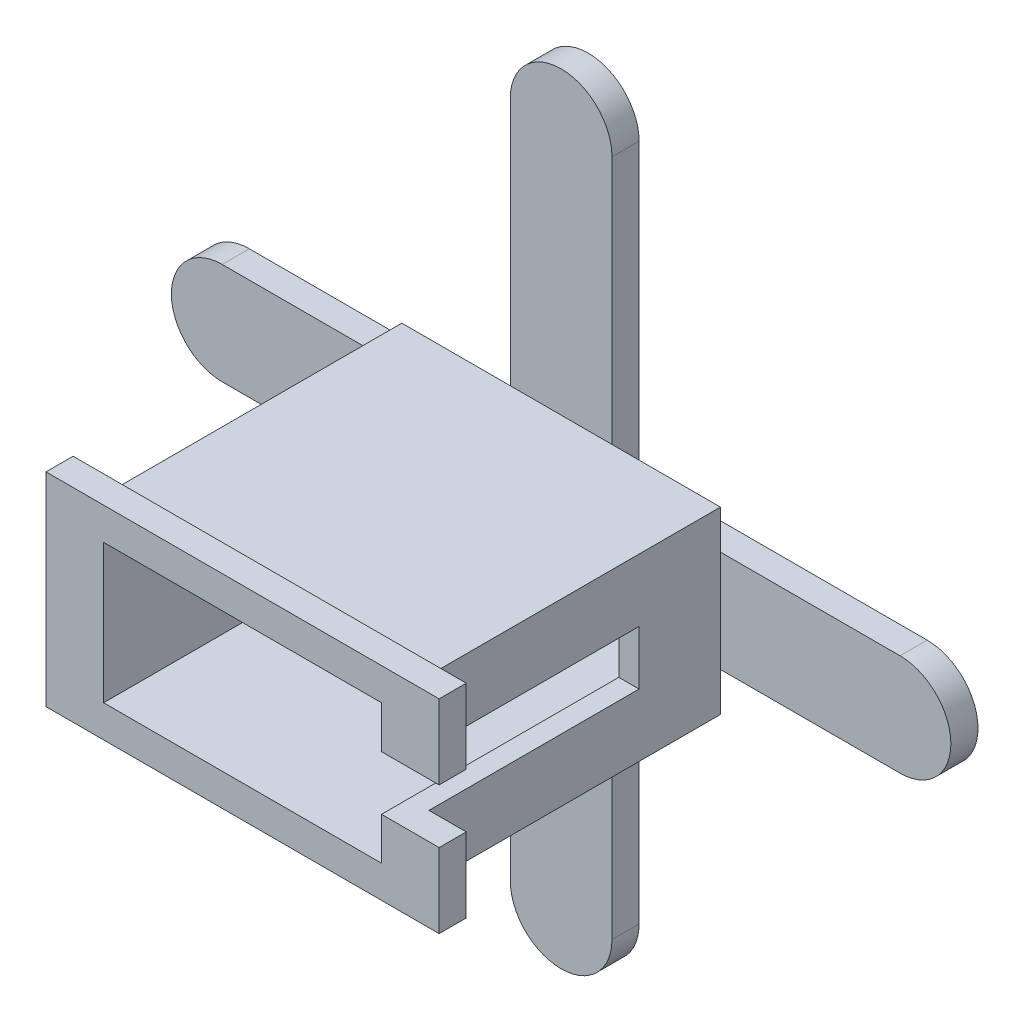
from build123d import *

# Parameters (mm, degrees)
EXTRUDE_1_DEPTH     = 4
SKETCH_2_W          = 47
SKETCH_2_H          = 26.5
SKETCH_2_W_2        = 41
SKETCH_2_H_2        = 20.5
EXTRUDE_2_DEPTH     = 43
SKETCH_3_W          = 58
SKETCH_3_H          = 30
SKETCH_3_W_2        = 41
SKETCH_3_H_2        = 20.5
EXTRUDE_3_DEPTH     = 4
SKETCH_4_W          = 43.435998006
SKETCH_4_H          = 8
CUT_EXTRUDE_1_DEPTH = 35


with BuildPart() as part:
    # 草图1 → 凸台-拉伸1 (new body)
    with BuildSketch(Plane.XY):
        with BuildLine():
            Line((-7.5, 50), (-7.5, 7.5))
            Line((-7.5, 7.5), (-50, 7.5))
            ThreePointArc((-50, 7.5), (-57.5, 0), (-50, -7.5))
            Line((-50, -7.5), (-7.5, -7.5))
            Line((-7.5, -7.5), (-7.5, -50))
            ThreePointArc((-7.5, -50), (0, -57.5), (7.5, -50))
            Line((7.5, -50), (7.5, -7.5))
            Line((7.5, -7.5), (50, -7.5))
            ThreePointArc((50, -7.5), (57.5, 0), (50, 7.5))
            Line((50, 7.5), (7.5, 7.5))
            Line((7.5, 7.5), (7.5, 50))
            ThreePointArc((7.5, 50), (0, 57.5), (-7.5, 50))
        make_face()
    extrude(amount=EXTRUDE_1_DEPTH)

    # 草图2 → 凸台-拉伸2 (add)
    with BuildSketch(Plane.XY.offset(4)):
        Rectangle(SKETCH_2_W, SKETCH_2_H)
        Rectangle(SKETCH_2_W_2, SKETCH_2_H_2, mode=Mode.SUBTRACT)
    extrude(amount=EXTRUDE_2_DEPTH)

    # 草图3 → 凸台-拉伸3 (add)
    with BuildSketch(Plane.XY.offset(47)):
        Rectangle(SKETCH_3_W, SKETCH_3_H)
        Rectangle(SKETCH_3_W_2, SKETCH_3_H_2, mode=Mode.SUBTRACT)
    extrude(amount=EXTRUDE_3_DEPTH)

    # 草图4 → 切除-拉伸1 (cut)
    with BuildSketch(Plane.XY.offset(51)):
        with Locations((17.279283878, 0)):
            Rectangle(SKETCH_4_W, SKETCH_4_H)
    extrude(amount=-CUT_EXTRUDE_1_DEPTH, mode=Mode.SUBTRACT)


solid = part.part
